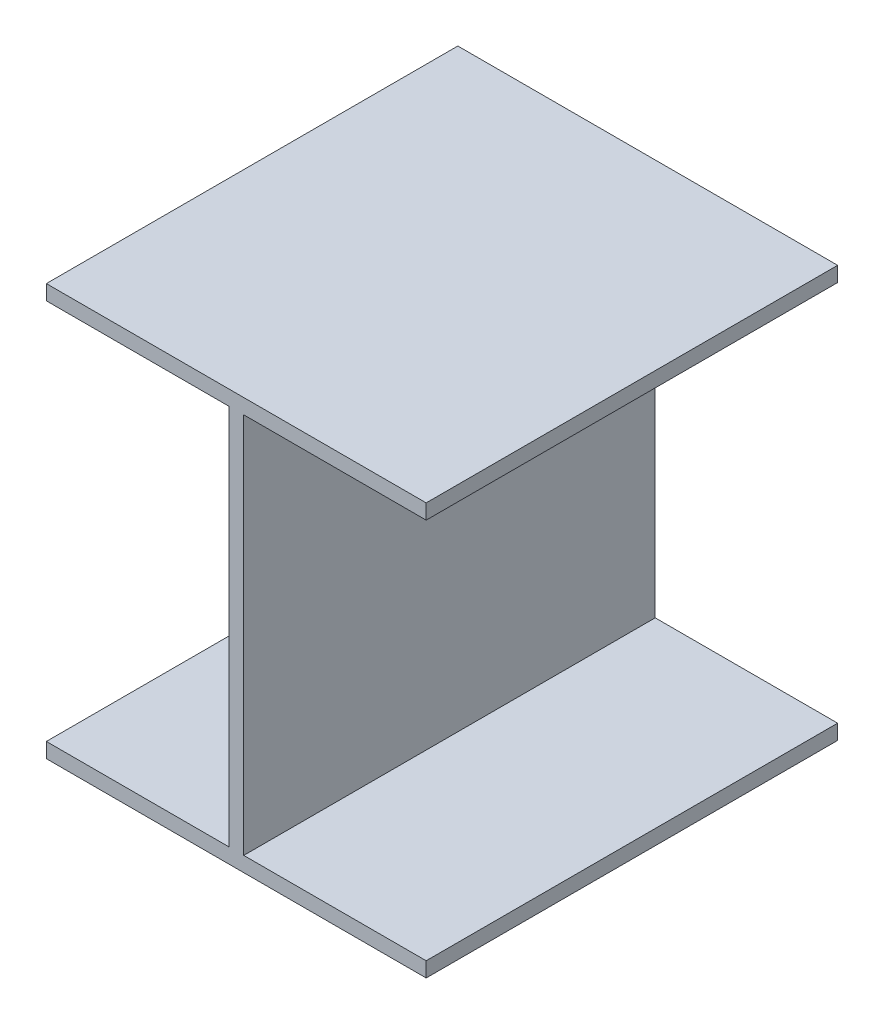
from build123d import *

# Parameters (mm, degrees)
BOSS_EXTRUDE1_DEPTH = 165.1


with BuildPart() as part:
    # Sketch1 → Boss-Extrude1 (new body)
    with BuildSketch(Plane.XY):
        Polygon((3, -76.55), (76.2, -76.55), (76.2, -82.55), (-76.2, -82.55), (-76.2, -76.55), (-3, -76.55), (-3, 76.55), (-76.2, 76.55), (-76.2, 82.55), (76.2, 82.55), (76.2, 76.55), (3, 76.55), align=None)
    extrude(amount=BOSS_EXTRUDE1_DEPTH)


solid = part.part
